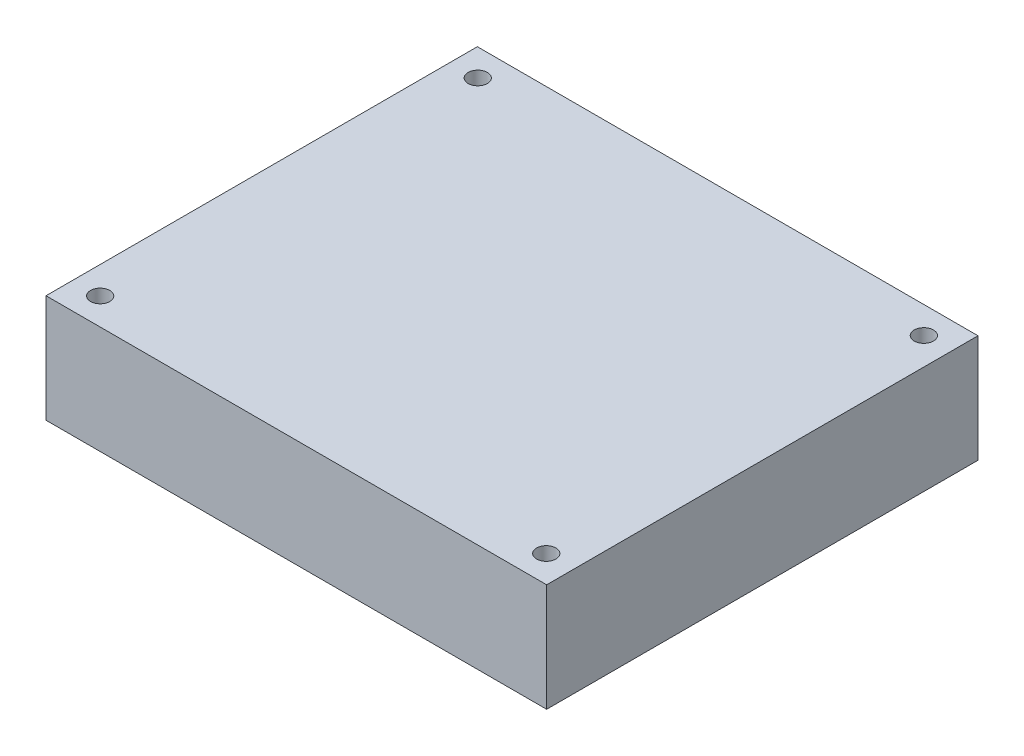
from build123d import *

# Parameters (mm, degrees)
SKETCH1_W           = 65
SKETCH1_H           = 56
BOSS_EXTRUDE1_DEPTH = 14
SKETCH2_R           = 1.25
CUT_EXTRUDE1_DEPTH  = 14


with BuildPart() as part:
    # Sketch1 → Boss-Extrude1 (new body)
    with BuildSketch(Plane(origin=(0, 0, 0), x_dir=(1, 0, 0), z_dir=(0, 1, 0))):
        Rectangle(SKETCH1_W, SKETCH1_H)
    extrude(amount=BOSS_EXTRUDE1_DEPTH)

    # Sketch2 → Cut-Extrude1 (cut)
    with BuildSketch(Plane.XZ):
        with Locations(Location((28.956, 24.511, 0), (0, 0, 270))):
            Circle(SKETCH2_R)
        with Locations(Location((28.956, -24.511, 0), (0, 0, 270))):
            Circle(SKETCH2_R)
        with Locations(Location((-28.956, -24.511, 0), (0, 0, 270))):
            Circle(SKETCH2_R)
        with Locations(Location((-28.956, 24.511, 0), (0, 0, 270))):
            Circle(SKETCH2_R)
    extrude(amount=-CUT_EXTRUDE1_DEPTH, mode=Mode.SUBTRACT)


solid = part.part
